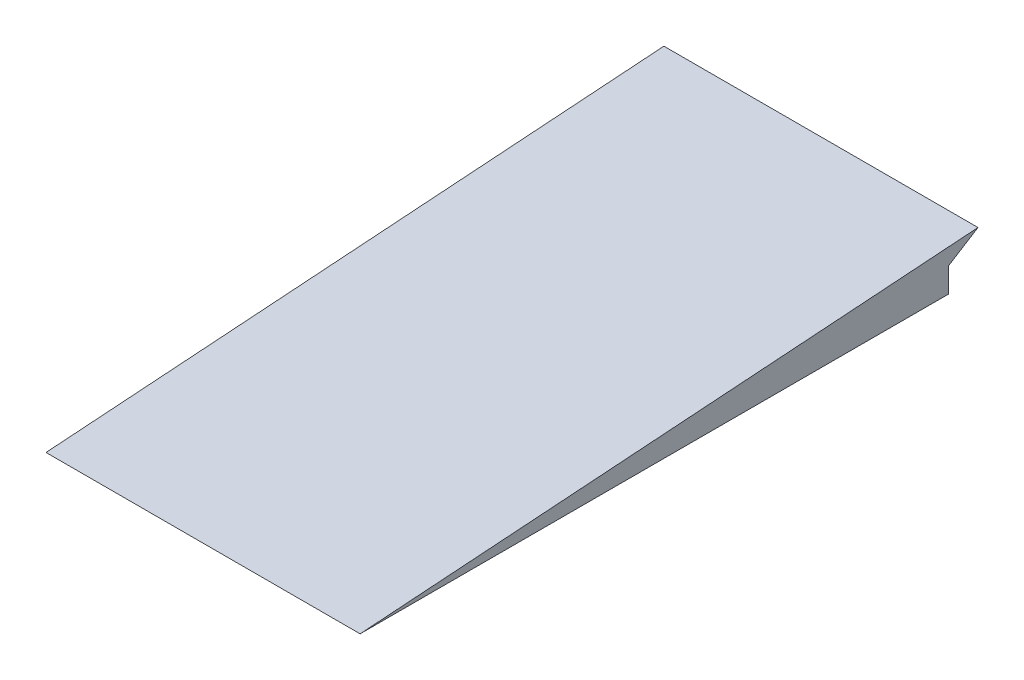
from build123d import *

# Parameters (mm, degrees)
BOSS_EXTRUDE1_DEPTH = 812.8
BOSS_EXTRUDE2_DEPTH = 1625.6


with BuildPart() as part:
    # Sketch1 → Boss-Extrude1 (new, symmetric)
    with BuildSketch(Plane(origin=(0, 0, 0), x_dir=(0, 0, -1), z_dir=(1, 0, 0))):
        Polygon((0, 0), (3045.353017304, 127), (3045.353017304, 0), align=None)
    extrude(amount=BOSS_EXTRUDE1_DEPTH, both=True)

    # Sketch2 → Boss-Extrude2 (add)
    with BuildSketch(Plane(origin=(812.8, 0, 0), x_dir=(0, 0, -1), z_dir=(1, 0, 0))):
        Polygon((3045.353017304, 127), (3197.753017304, 222.25), (0, 0), align=None)
    extrude(amount=-BOSS_EXTRUDE2_DEPTH)


solid = part.part
